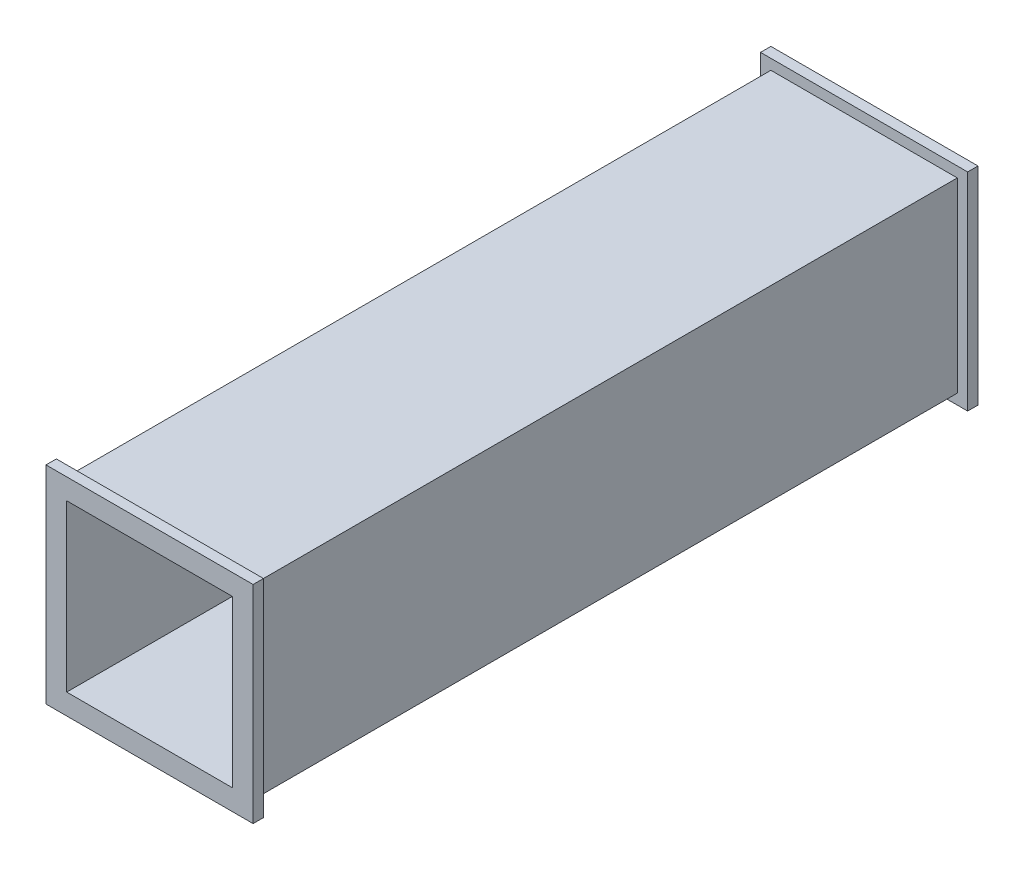
from build123d import *

# Parameters (mm, degrees)
SKETCH1_W           = 90
SKETCH1_H           = 90
BOSS_EXTRUDE1_DEPTH = 350
SHELL3_T            = -5
SKETCH2_W           = 100
SKETCH2_H           = 50
CUT_EXTRUDE1_DEPTH  = 20
SKETCH9_W           = 100
SKETCH9_H           = 100
SKETCH9_W_2         = 90
SKETCH9_H_2         = 90
BOSS_EXTRUDE8_DEPTH = 5
SKETCH10_W          = 100
SKETCH10_H          = 100
SKETCH10_W_2        = 90
SKETCH10_H_2        = 90
BOSS_EXTRUDE9_DEPTH = 5


with BuildPart() as part:
    # Sketch1 → Boss-Extrude1 (new body)
    with BuildSketch(Plane.XY):
        Rectangle(SKETCH1_W, SKETCH1_H)
    extrude(amount=BOSS_EXTRUDE1_DEPTH)

    # Shell3
    shell3_openings = [part.faces().sort_by_distance(p)[0] for p in [
        (0, 0, 350),
        (0, 0, 0),
    ]]
    offset(amount=SHELL3_T, openings=shell3_openings, kind=Kind.INTERSECTION)

    # Sketch2 → Cut-Extrude1 (cut)
    with BuildSketch(Plane.ZY.offset(45)):
        with Locations((175, 0)):
            Rectangle(SKETCH2_W, SKETCH2_H)
    extrude(amount=-CUT_EXTRUDE1_DEPTH, mode=Mode.SUBTRACT)

    # Sketch9 → Boss-Extrude8 (add)
    with BuildSketch(Plane.XY.offset(350)):
        Rectangle(SKETCH9_W, SKETCH9_H)
        Rectangle(SKETCH9_W_2, SKETCH9_H_2, mode=Mode.SUBTRACT)
    extrude(amount=-BOSS_EXTRUDE8_DEPTH)

    # Sketch10 → Boss-Extrude9 (add)
    with BuildSketch(Plane(origin=(0, 0, 0), x_dir=(-1, 0, 0), z_dir=(0, 0, -1))):
        Rectangle(SKETCH10_W, SKETCH10_H)
        Rectangle(SKETCH10_W_2, SKETCH10_H_2, mode=Mode.SUBTRACT)
    extrude(amount=-BOSS_EXTRUDE9_DEPTH)


solid = part.part
